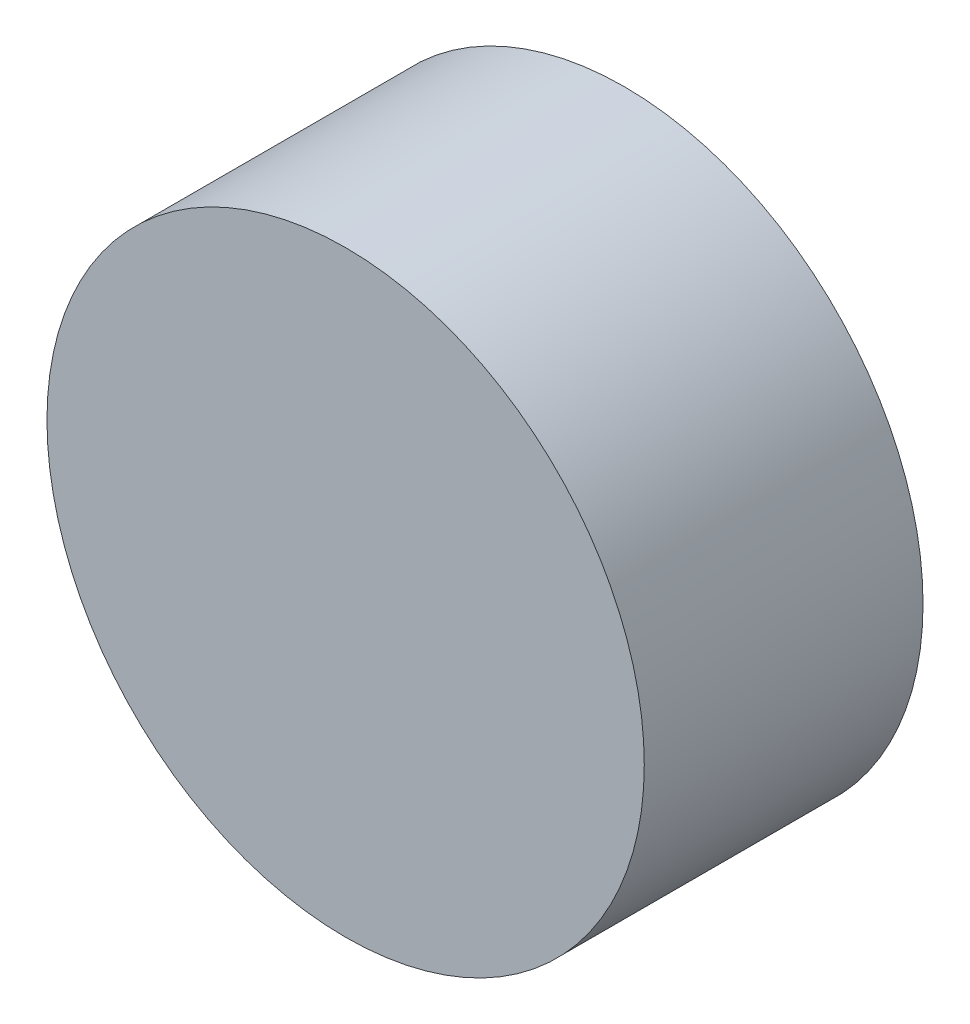
from build123d import *

# Parameters (mm, degrees)
SKETCH_1_R                      = 30
WHEEL_WIDTH28_PLACEHOLDER_DEPTH = 28


with BuildPart() as part:
    # 草图1 → Wheel_width28_PLACEHOLDER (new body)
    with BuildSketch(Plane.XY):
        Circle(SKETCH_1_R)
    extrude(amount=WHEEL_WIDTH28_PLACEHOLDER_DEPTH)


solid = part.part
